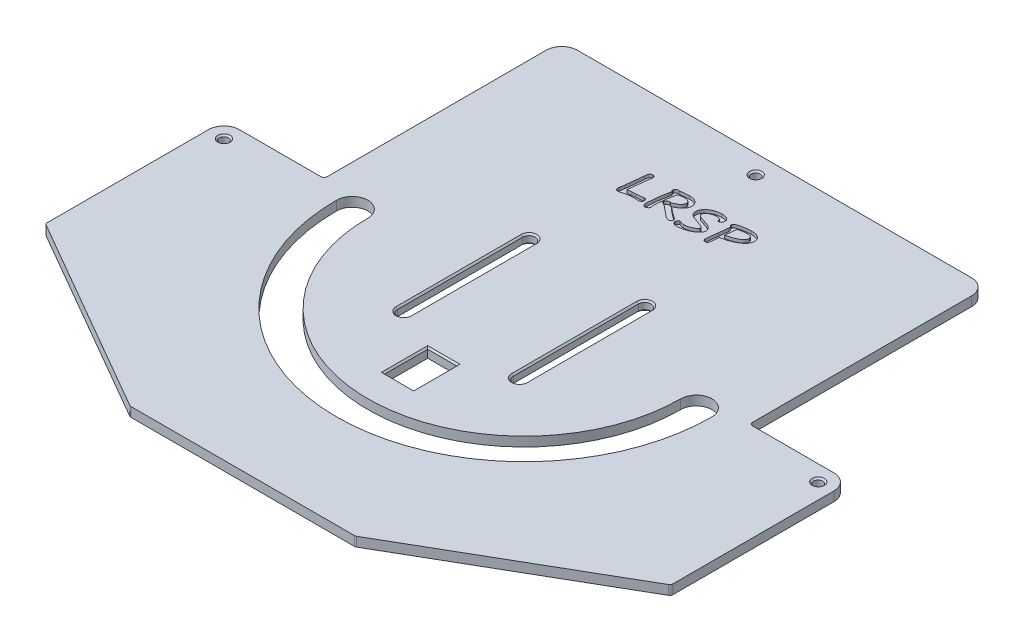
from build123d import *

# Parameters (mm, degrees)
SKETCH_1_R          = 1.45
EXTRUDE_1_DEPTH     = 3
CUT_EXTRUDE_1_DEPTH = 198.253643819
CUT_EXTRUDE_START   = 3
CUT_EXTRUDE_2_DEPTH = 1
CUT_EXTRUDE_3_DEPTH = 198.253643958
SKETCH_5_W          = 9.3
SKETCH_5_H          = 13.8
CUT_EXTRUDE_4_DEPTH = 198.253643958
CHAMFER_1_SIZE      = 0.5


with BuildPart() as part:
    # 草图1 → 凸台-拉伸1 (new body)
    with BuildSketch(Plane(origin=(0, 0, 0), x_dir=(1, 0, 0), z_dir=(0, 1, 0))):
        with BuildLine():
            Line((-100, -81), (-100, -132.472232503))
            ThreePointArc((-100, -132.472232503), (-99.866025404, -132.972232503), (-99.5, -133.338257906))
            Line((-99.5, -133.338257906), (-36.232050808, -169.866025404))
            ThreePointArc((-36.232050808, -169.866025404), (-35.990869853, -169.965925826), (-35.732050808, -170))
            Line((-35.732050808, -170), (35.732050808, -170))
            ThreePointArc((35.732050808, -170), (35.990869853, -169.965925826), (36.232050808, -169.866025404))
            Line((36.232050808, -169.866025404), (99.5, -133.338257906))
            ThreePointArc((99.5, -133.338257906), (99.866025404, -132.972232503), (100, -132.472232503))
            Line((100, -132.472232503), (100, -81))
            ThreePointArc((100, -81), (98.535533906, -77.464466094), (95, -76))
            Line((95, -76), (69, -76))
            ThreePointArc((69, -76), (68.292893219, -75.707106781), (68, -75))
            Line((68, -75), (68, -5))
            ThreePointArc((68, -5), (66.535533906, -1.464466094), (63, 0))
            Line((63, 0), (-63, 0))
            ThreePointArc((-63, 0), (-66.535533906, -1.464466094), (-68, -5))
            Line((-68, -5), (-68, -75))
            ThreePointArc((-68, -75), (-68.292893219, -75.707106781), (-69, -76))
            Line((-69, -76), (-95, -76))
            ThreePointArc((-95, -76), (-98.535533906, -77.464466094), (-100, -81))
        make_face()
        with Locations(Location((95, -81, 0), (0, 0, 270))):
            Circle(SKETCH_1_R, mode=Mode.SUBTRACT)
        with Locations(Location((0, -6, 0), (0, 0, 270))):
            Circle(SKETCH_1_R, mode=Mode.SUBTRACT)
        with Locations(Location((-95, -81, 0), (0, 0, 270))):
            Circle(SKETCH_1_R, mode=Mode.SUBTRACT)
    extrude(amount=EXTRUDE_1_DEPTH)

    # 草图2 → 切除-拉伸1 (cut, through all)
    with BuildSketch(Plane(origin=(0, 0, 0), x_dir=(1, 0, 0), z_dir=(0, 1, 0))):
        with BuildLine():
            Line((16.5, -60), (16.5, -100))
            ThreePointArc((16.5, -100), (18.5, -102), (20.5, -100))
            Line((20.5, -100), (20.5, -60))
            ThreePointArc((20.5, -60), (18.5, -58), (16.5, -60))
        make_face()
        with BuildLine():
            Line((-16.5, -60), (-16.5, -100))
            ThreePointArc((-16.5, -100), (-18.5, -102), (-20.5, -100))
            Line((-20.5, -100), (-20.5, -60))
            ThreePointArc((-20.5, -60), (-18.5, -58), (-16.5, -60))
        make_face()
    extrude(amount=CUT_EXTRUDE_1_DEPTH, mode=Mode.SUBTRACT)

    # 草图3 → 切除-拉伸2 (cut)
    # profile 1 of 4: a face of its own
    with BuildSketch(Plane(origin=(0, 0, 0), x_dir=(1, 0, 0), z_dir=(0, 1, 0)).offset(CUT_EXTRUDE_START)):
        with BuildLine():
            add(Edge.make_bspline(
                [(-11.805058624, -31.89246865), (-11.837123005, -31.89211356), (-11.910680979, -31.89129896), (-12.036132461, -31.881463546), (-12.191190699, -31.870564276), (-12.304554971, -31.858784685), (-12.36595606, -31.852404547)],
                knots=[0, 0, 0, 0, 0.683887348, 1.568886302, 2.683244508, 4, 4, 4, 4], degree=3))
            add(Edge.make_bspline(
                [(-12.36595606, -31.852404547), (-12.428063248, -31.847844528), (-12.543594902, -31.839361991), (-12.703676241, -31.825957517), (-12.837996589, -31.819985546), (-12.918837283, -31.818854564), (-12.954898367, -31.81835006)],
                knots=[0, 0, 0, 0, 1.266455151, 2.355857056, 3.266587467, 4, 4, 4, 4], degree=3))
            add(Edge.make_bspline(
                [(-12.954898367, -31.81835006), (-13.108517727, -31.819693623), (-13.414644899, -31.822371027), (-13.872293221, -31.850057608), (-14.326004476, -31.891489288), (-14.777110999, -31.949829727), (-15.224356833, -32.02517696), (-15.668283462, -32.120738661), (-16.108986773, -32.229610911), (-16.399391583, -32.31600442), (-16.544641957, -32.359215445)],
                knots=[0, 0, 0, 0, 1.011654307, 2.01598857, 3.018559227, 4.011895031, 5.011084001, 6.004741019, 7.002040933, 8, 8, 8, 8], degree=3))
            add(Edge.make_bspline(
                [(-16.544641957, -32.359215445), (-16.601982549, -32.377514955), (-16.712275556, -32.412713545), (-16.872522688, -32.459094565), (-17.019888071, -32.496163081), (-17.153869392, -32.529273345), (-17.274653279, -32.555395488), (-17.383541607, -32.574050853), (-17.479280862, -32.584240884), (-17.538882115, -32.586529099), (-17.566276572, -32.587580829)],
                knots=[0, 0, 0, 0, 1.375863812, 2.64643512, 3.81259638, 4.849189715, 5.801193257, 6.636810002, 7.373438485, 8, 8, 8, 8], degree=3))
            add(Edge.make_bspline(
                [(-17.566276572, -32.587580829), (-17.631583567, -32.584105933), (-17.757890113, -32.577385333), (-17.93566325, -32.514340393), (-18.090841284, -32.411898613), (-18.212948103, -32.270068767), (-18.310372363, -32.115044142), (-18.383290006, -31.958308114), (-18.431409869, -31.804473243), (-18.436977222, -31.701812281), (-18.439674008, -31.652084034)],
                knots=[0, 0, 0, 0, 1.105349252, 2.137793168, 3.159541136, 4.227044925, 5.286817455, 6.260596173, 7.157445041, 8, 8, 8, 8], degree=3))
            add(Edge.make_bspline(
                [(-18.439674008, -31.652084034), (-18.437388787, -31.623990258), (-18.431532784, -31.551998457), (-18.40689988, -31.421959219), (-18.370832083, -31.245036537), (-18.340501669, -31.111824237), (-18.323488111, -31.03710006)],
                knots=[0, 0, 0, 0, 0.539700042, 1.38301016, 2.532024359, 4, 4, 4, 4], degree=3))
            add(Edge.make_bspline(
                [(-18.323488111, -31.03710006), (-18.298612431, -30.931108299), (-18.247341134, -30.712648544), (-18.184728008, -30.372252314), (-18.127764104, -30.010298915), (-18.0982867, -29.761172929), (-18.083103496, -29.632853265)],
                knots=[0, 0, 0, 0, 0.916294122, 1.888575003, 2.912448473, 4, 4, 4, 4], degree=3))
            Line((-18.083103496, -29.632853265), (-17.498167598, -24.089984675))
            add(Edge.make_bspline(
                [(-17.498167598, -24.089984675), (-17.492341064, -24.027198812), (-17.48117916, -23.906919789), (-17.462434783, -23.73612357), (-17.44756252, -23.581589225), (-17.429063775, -23.44556606), (-17.412307155, -23.326164947), (-17.400306101, -23.224110387), (-17.382956418, -23.140407553), (-17.365818601, -23.050570987), (-17.330731889, -22.951494733), (-17.26753322, -22.841050967), (-17.179155897, -22.739823403), (-17.07357773, -22.641821014), (-16.943051152, -22.560146239), (-16.790782566, -22.499140513), (-16.616826586, -22.466016285), (-16.494697433, -22.461664616), (-16.430459265, -22.459375701)],
                knots=[0, 0, 0, 0, 1.354080732, 2.594015579, 3.689841574, 4.687650921, 5.541425648, 6.279598573, 6.892687215, 7.376420873, 8.242628706, 9.135488107, 10.092054636, 11.117406845, 12.219407611, 13.377719284, 14.620718259, 16, 16, 16, 16], degree=3))
            add(Edge.make_bspline(
                [(-16.430459265, -22.459375701), (-16.378005048, -22.461681981), (-16.27364688, -22.466270346), (-16.124028891, -22.515226047), (-15.984408885, -22.590704203), (-15.860812547, -22.694307646), (-15.75732265, -22.814161451), (-15.675089486, -22.940602866), (-15.629714309, -23.076764843), (-15.622660138, -23.168889263), (-15.619161188, -23.214584034)],
                knots=[0, 0, 0, 0, 1.030694139, 2.050575912, 3.069438142, 4.144550581, 5.208080997, 6.183249121, 7.098870669, 8, 8, 8, 8], degree=3))
            add(Edge.make_bspline(
                [(-15.619161188, -23.214584034), (-15.621429489, -23.264688931), (-15.626732962, -23.381838275), (-15.647212489, -23.582636406), (-15.687831619, -23.832483721), (-15.718565685, -24.015885431), (-15.735347085, -24.116026342)],
                knots=[0, 0, 0, 0, 0.661571546, 1.546808336, 2.660509497, 4, 4, 4, 4], degree=3))
            add(Edge.make_bspline(
                [(-15.735347085, -24.116026342), (-15.750161787, -24.202142411), (-15.7828623, -24.392226531), (-15.83339714, -24.70381474), (-15.883905494, -25.06951006), (-15.942882813, -25.487966722), (-16.00445636, -25.960807042), (-16.070456013, -26.487000622), (-16.140262308, -27.066635305), (-16.201143241, -27.57736663), (-16.246618215, -27.995747425), (-16.2838448, -28.29593454), (-16.316200967, -28.57702573), (-16.342940761, -28.839069446), (-16.371477073, -29.081330061), (-16.398287921, -29.304190884), (-16.419546176, -29.508012059), (-16.439811428, -29.692281581), (-16.457523479, -29.856577509), (-16.474440466, -30.001315018), (-16.486056224, -30.126957439), (-16.495356251, -30.233946438), (-16.506100713, -30.321184381), (-16.513034932, -30.389286539), (-16.513854355, -30.437515922), (-16.515858086, -30.462851985), (-16.516597085, -30.472196214)],
                knots=[0, 0, 0, 0, 0.98225695, 2.16813713, 3.548102444, 5.131890826, 6.918528995, 8.908092068, 11.093182547, 13.481289169, 14.689828606, 15.823809401, 16.881492836, 17.870380939, 18.784668621, 19.623531621, 20.393585074, 21.088206459, 21.70739639, 22.251155734, 22.726174843, 23.125760364, 23.458150875, 23.714347134, 23.894647964, 24, 24, 24, 24], degree=3))
            add(Edge.make_bspline(
                [(-16.516597085, -30.472196214), (-16.516451592, -30.500572011), (-16.516199504, -30.549737116), (-16.502129982, -30.608975495), (-16.484554709, -30.655370797), (-16.459502269, -30.661714802), (-16.448488111, -30.664503906)],
                knots=[0, 0, 0, 0, 1.534580987, 2.658879895, 3.41038444, 4, 4, 4, 4], degree=3))
            add(Edge.make_bspline(
                [(-16.448488111, -30.664503906), (-16.422432605, -30.664116521), (-16.360879301, -30.663201365), (-16.254800435, -30.653498551), (-16.119789619, -30.642275442), (-15.95699128, -30.623432742), (-15.765378769, -30.601234428), (-15.546186932, -30.575899683), (-15.298520505, -30.543248579), (-15.124353672, -30.519050902), (-15.032222085, -30.506250701)],
                knots=[0, 0, 0, 0, 0.438554189, 1.036036653, 1.792216727, 2.719537529, 3.79459464, 5.039741336, 6.434068498, 8, 8, 8, 8], degree=3))
            add(Edge.make_bspline(
                [(-15.032222085, -30.506250701), (-14.850125061, -30.483374985), (-14.485378251, -30.437554112), (-14.118288638, -30.41792372), (-13.934465675, -30.40809365)],
                knots=[0, 0, 0, 0, 0.998484535, 2, 2, 2, 2], degree=3))
            add(Edge.make_bspline(
                [(-13.934465675, -30.40809365), (-13.8069182, -30.402302968), (-13.562446946, -30.391203922), (-13.210443186, -30.371739753), (-12.887940585, -30.347532144), (-12.594886284, -30.321094306), (-12.33148015, -30.29638064), (-12.098266775, -30.266574048), (-11.894683883, -30.232627779), (-11.768945088, -30.207398811), (-11.710907983, -30.195753906)],
                knots=[0, 0, 0, 0, 1.370474625, 2.626799539, 3.783936834, 4.841642969, 5.785172089, 6.623501973, 7.364651456, 8, 8, 8, 8], degree=3))
            add(Edge.make_bspline(
                [(-11.710907983, -30.195753906), (-11.678896911, -30.188866273), (-11.620373788, -30.176274198), (-11.538942499, -30.161786807), (-11.471395058, -30.152915833), (-11.430478561, -30.152060624), (-11.412430419, -30.151683393)],
                knots=[0, 0, 0, 0, 1.299758004, 2.376237091, 3.283763088, 4, 4, 4, 4], degree=3))
            add(Edge.make_bspline(
                [(-11.412430419, -30.151683393), (-11.353473662, -30.154369951), (-11.24073914, -30.159507068), (-11.080634745, -30.198509658), (-10.942941107, -30.271503229), (-10.826881349, -30.367546073), (-10.73427764, -30.482485062), (-10.666607791, -30.610134632), (-10.627827595, -30.749768665), (-10.622086292, -30.84589675), (-10.619161188, -30.894872496)],
                knots=[0, 0, 0, 0, 1.161583679, 2.221129313, 3.215774719, 4.206408386, 5.170199741, 6.106009512, 7.035041664, 8, 8, 8, 8], degree=3))
            add(Edge.make_bspline(
                [(-10.619161188, -30.894872496), (-10.622912023, -30.966914554), (-10.630214201, -31.107167027), (-10.701925682, -31.305902822), (-10.81989029, -31.480093904), (-10.97897578, -31.62700503), (-11.166044661, -31.741445847), (-11.366636374, -31.831123765), (-11.582281226, -31.881362764), (-11.730030968, -31.888728376), (-11.805058624, -31.89246865)],
                knots=[0, 0, 0, 0, 1.000384199, 1.947561754, 2.899385267, 3.906104484, 4.93827777, 5.942114557, 6.95500109, 8, 8, 8, 8], degree=3))
        make_face()
    # profile 2 of 4: a face of its own
    with BuildSketch(Plane(origin=(0, 0, 0), x_dir=(1, 0, 0), z_dir=(0, 1, 0)).offset(CUT_EXTRUDE_START)):
        with BuildLine():
            Line((-8.758183624, -24.061939804), (-8.846324649, -23.905689804))
            add(Edge.make_bspline(
                [(-8.846324649, -23.905689804), (-8.881120819, -23.853362679), (-8.944239441, -23.758443724), (-9.020023391, -23.623840745), (-9.069592362, -23.509704791), (-9.07734712, -23.437923948), (-9.080699649, -23.406891727)],
                knots=[0, 0, 0, 0, 1.352017455, 2.452496373, 3.330984787, 4, 4, 4, 4], degree=3))
            add(Edge.make_bspline(
                [(-9.080699649, -23.406891727), (-9.077098919, -23.35413952), (-9.069806607, -23.247304089), (-9.000614074, -23.096188551), (-8.891478568, -22.958202301), (-8.747701806, -22.838424055), (-8.590490842, -22.735805879), (-8.431965684, -22.660783505), (-8.281858313, -22.610039936), (-8.182270625, -22.604311566), (-8.135186829, -22.601603265)],
                knots=[0, 0, 0, 0, 0.934415258, 1.892407207, 2.900174388, 4.045950996, 5.206116578, 6.231935585, 7.164081556, 8, 8, 8, 8], degree=3))
            add(Edge.make_bspline(
                [(-8.135186829, -22.601603265), (-8.088405917, -22.602283304), (-7.983261539, -22.603811753), (-7.878715156, -22.615273267), (-7.820683624, -22.621635316)],
                knots=[0, 0, 0, 0, 0.889841422, 2, 2, 2, 2], degree=3))
            add(Edge.make_bspline(
                [(-7.820683624, -22.621635316), (-7.792001924, -22.625895545), (-7.740704368, -22.633515012), (-7.673039666, -22.640313397), (-7.62450194, -22.647718612), (-7.598339901, -22.649136647), (-7.588311829, -22.649680188)],
                knots=[0, 0, 0, 0, 1.485964319, 2.657664535, 3.485474476, 4, 4, 4, 4], degree=3))
            add(Edge.make_bspline(
                [(-7.588311829, -22.649680188), (-7.428070117, -22.624882597), (-7.119725833, -22.57716596), (-6.676011811, -22.509997198), (-6.269197369, -22.456027596), (-5.899785386, -22.412557044), (-5.56819303, -22.374443097), (-5.273426156, -22.352085155), (-5.016440201, -22.333039212), (-4.857304293, -22.331760847), (-4.783824649, -22.331170573)],
                knots=[0, 0, 0, 0, 1.37768864, 2.651010233, 3.812841483, 4.86417217, 5.811467902, 6.648223788, 7.375828904, 8, 8, 8, 8], degree=3))
            add(Edge.make_bspline(
                [(-4.783824649, -22.331170573), (-4.660878969, -22.333502741), (-4.421177915, -22.338049654), (-4.07174399, -22.372645994), (-3.742211458, -22.428140606), (-3.432217589, -22.50567325), (-3.142008608, -22.607465627), (-2.873060274, -22.735529894), (-2.620412526, -22.879972609), (-2.393204556, -23.051864473), (-2.187680038, -23.236465565), (-2.006923071, -23.433432187), (-1.857496875, -23.643187268), (-1.729085153, -23.860551601), (-1.637755557, -24.092843415), (-1.564540271, -24.332612206), (-1.525182263, -24.584818778), (-1.519485423, -24.756265257), (-1.516597085, -24.843189804)],
                knots=[0, 0, 0, 0, 1.28017223, 2.495887868, 3.652806582, 4.757492117, 5.819780216, 6.84943017, 7.856021703, 8.844850528, 9.809846264, 10.730399304, 11.622027755, 12.487987491, 13.351878693, 14.214425491, 15.094701412, 16, 16, 16, 16], degree=3))
            add(Edge.make_bspline(
                [(-1.516597085, -24.843189804), (-1.519402663, -24.927486402), (-1.525000663, -25.095684318), (-1.567035265, -25.346037578), (-1.632988123, -25.593066336), (-1.726190638, -25.837422465), (-1.846768565, -26.078448325), (-1.996532481, -26.314278545), (-2.169847038, -26.548577769), (-2.369392949, -26.77704815), (-2.592320001, -26.998320188), (-2.831844374, -27.213174224), (-3.09163006, -27.415455366), (-3.368655172, -27.607707731), (-3.663315224, -27.791259122), (-3.978942016, -27.959174704), (-4.308759069, -28.12383421), (-4.5388353, -28.219905712), (-4.655619521, -28.268670573)],
                knots=[0, 0, 0, 0, 0.823035889, 1.64221242, 2.472785214, 3.317047108, 4.19206172, 5.10046756, 6.042255036, 7.036187588, 8.059992077, 9.108570523, 10.177099954, 11.273490121, 12.401056221, 13.565443191, 14.764245144, 16, 16, 16, 16], degree=3))
            add(Edge.make_bspline(
                [(-4.655619521, -28.268670573), (-4.463658652, -28.426682389), (-4.093839976, -28.731097144), (-3.553211253, -29.16464649), (-3.050116759, -29.561364703), (-2.580896941, -29.918114023), (-2.148380612, -30.236984161), (-1.752580481, -30.518159771), (-1.39153328, -30.759521292), (-1.160375643, -30.903432119), (-1.051853496, -30.970994291)],
                knots=[0, 0, 0, 0, 1.323715451, 2.550179614, 3.689517397, 4.734737472, 5.688250265, 6.550342628, 7.319425767, 8, 8, 8, 8], degree=3))
            add(Edge.make_bspline(
                [(-1.051853496, -30.970994291), (-0.985931115, -31.015483091), (-0.862431945, -31.09882853), (-0.72181047, -31.26370776), (-0.632919081, -31.448933213), (-0.623746527, -31.581705207), (-0.619161188, -31.648077624)],
                knots=[0, 0, 0, 0, 1.129677909, 2.1163417, 3.058363512, 4, 4, 4, 4], degree=3))
            add(Edge.make_bspline(
                [(-0.619161188, -31.648077624), (-0.6236489, -31.693295785), (-0.633008355, -31.787601592), (-0.69306841, -31.927007269), (-0.793915295, -32.062205433), (-0.923243209, -32.191516677), (-1.067201443, -32.306748713), (-1.21500773, -32.391961113), (-1.358801291, -32.450069165), (-1.456023721, -32.456362431), (-1.502574649, -32.459375701)],
                knots=[0, 0, 0, 0, 0.841672582, 1.7553702, 2.779405572, 3.965487903, 5.151114612, 6.197517985, 7.136956254, 8, 8, 8, 8], degree=3))
            add(Edge.make_bspline(
                [(-1.502574649, -32.459375701), (-1.570418418, -32.454459035), (-1.712652078, -32.444151302), (-1.930979591, -32.376659045), (-2.160961484, -32.268795308), (-2.359216264, -32.146390938), (-2.526580303, -32.024929882), (-2.672190555, -31.923353839), (-2.829221905, -31.807915058), (-2.997978394, -31.677703528), (-3.181896057, -31.539591316), (-3.376357498, -31.385802356), (-3.584677428, -31.221533165), (-3.801022492, -31.051577577), (-4.008322158, -30.880365487), (-4.201137642, -30.727732929), (-4.368416175, -30.590431107), (-4.510535878, -30.471300654), (-4.63073638, -30.371967932), (-4.726535348, -30.291566376), (-4.796477731, -30.226430213), (-4.835890167, -30.190391844), (-4.851933624, -30.175721855)],
                knots=[0, 0, 0, 0, 0.992333548, 2.080415577, 3.317207631, 4.702550758, 5.480326911, 6.342124064, 7.299371984, 8.330831358, 9.459961446, 10.663564122, 11.957135927, 13.340687425, 14.687658185, 15.889674563, 16.937695597, 17.853118788, 18.602216131, 19.218796807, 19.681998858, 20, 20, 20, 20], degree=3))
            add(Edge.make_bspline(
                [(-4.851933624, -30.175721855), (-4.954527388, -30.089297591), (-5.152198226, -29.922781072), (-5.440451726, -29.687754276), (-5.704086281, -29.473088287), (-5.945522164, -29.281714964), (-6.164721786, -29.113359135), (-6.363420626, -28.969835736), (-6.537413618, -28.846150937), (-6.647917801, -28.774483958), (-6.698888752, -28.741426983)],
                knots=[0, 0, 0, 0, 1.375867385, 2.650929722, 3.814688832, 4.862919684, 5.810835027, 6.649223912, 7.376943574, 8, 8, 8, 8], degree=3))
            add(Edge.make_bspline(
                [(-6.698888752, -28.741426983), (-6.755149165, -28.739103929), (-6.860683598, -28.734746296), (-7.009088622, -28.703089921), (-7.136405674, -28.647807714), (-7.2389643, -28.564809732), (-7.31962569, -28.461587674), (-7.376633044, -28.335519301), (-7.406986309, -28.18661884), (-7.411592505, -28.080502584), (-7.414032983, -28.024279547)],
                knots=[0, 0, 0, 0, 1.162557683, 2.180749487, 3.119881883, 4.003820435, 4.879201571, 5.805770099, 6.837442317, 8, 8, 8, 8], degree=3))
            add(Edge.make_bspline(
                [(-7.414032983, -28.024279547), (-7.410530948, -27.969494487), (-7.403546649, -27.860233667), (-7.334957928, -27.705968704), (-7.233436193, -27.562026856), (-7.089642959, -27.43991738), (-6.924835688, -27.334865579), (-6.742851184, -27.257727281), (-6.548812957, -27.212703896), (-6.416002798, -27.206252717), (-6.348327854, -27.202965445)],
                knots=[0, 0, 0, 0, 0.88284879, 1.760713261, 2.691247739, 3.718031532, 4.79242944, 5.849202722, 6.904036511, 8, 8, 8, 8], degree=3))
            add(Edge.make_bspline(
                [(-6.348327854, -27.202965445), (-6.306761191, -27.204352863), (-6.220189524, -27.207242466), (-6.135792234, -27.22683473), (-6.091917598, -27.237019932)],
                knots=[0, 0, 0, 0, 0.960283305, 2, 2, 2, 2], degree=3))
            add(Edge.make_bspline(
                [(-6.091917598, -27.237019932), (-6.054819293, -27.248505493), (-5.993829061, -27.267387947), (-5.930448012, -27.27435486), (-5.905619521, -27.277084034)],
                knots=[0, 0, 0, 0, 1.216532653, 2, 2, 2, 2], degree=3))
            add(Edge.make_bspline(
                [(-5.905619521, -27.277084034), (-5.86605269, -27.274187642), (-5.778425511, -27.267773111), (-5.637763678, -27.230182047), (-5.475351749, -27.173501025), (-5.290134439, -27.094164885), (-5.082871329, -26.991356733), (-4.852458535, -26.866905319), (-4.600092022, -26.719270112), (-4.330694586, -26.557573938), (-4.066930595, -26.380994518), (-3.832167192, -26.189200737), (-3.631925745, -25.991167468), (-3.46849734, -25.784933444), (-3.341616225, -25.571290567), (-3.250145797, -25.351091522), (-3.193628742, -25.122454633), (-3.18672041, -24.96703126), (-3.183263752, -24.889263521)],
                knots=[0, 0, 0, 0, 0.492315553, 1.090312831, 1.801777391, 2.631306072, 3.592885319, 4.677464868, 5.886326267, 7.227477105, 8.583676426, 9.828377845, 10.99064928, 12.078432911, 13.090707307, 14.06965274, 15.034130202, 16, 16, 16, 16], degree=3))
            add(Edge.make_bspline(
                [(-3.183263752, -24.889263521), (-3.184981702, -24.850452461), (-3.188386055, -24.773543062), (-3.210167585, -24.660493219), (-3.250138784, -24.552880535), (-3.301151394, -24.448031382), (-3.371722104, -24.348959214), (-3.455125608, -24.253126002), (-3.554801097, -24.162950736), (-3.706161544, -24.046398896), (-3.924369393, -23.922306372), (-4.219390754, -23.815278131), (-4.547604995, -23.753945935), (-4.776887676, -23.745707169), (-4.896004137, -23.741426983)],
                knots=[0, 0, 0, 0, 0.613816846, 1.216361632, 1.810804451, 2.424621297, 3.054304903, 3.727701513, 4.43010419, 5.175544776, 6.745703522, 8.375670931, 10.117096107, 12, 12, 12, 12], degree=3))
            add(Edge.make_bspline(
                [(-4.896004137, -23.741426983), (-5.036258213, -23.742279517), (-5.302904626, -23.743900326), (-5.681857272, -23.763960214), (-6.018476397, -23.795934582), (-6.270286829, -23.838199617), (-6.447343233, -23.874075199), (-6.559761041, -23.899446598), (-6.657386684, -23.917228247), (-6.738978706, -23.938971837), (-6.805553128, -23.95538318), (-6.856824763, -23.972152731), (-6.892859688, -23.984816354), (-6.922873553, -24.001599707), (-6.946201818, -24.033218359), (-6.975175398, -24.078428986), (-7.005588156, -24.140038172), (-7.035928351, -24.204881272), (-7.061858209, -24.280742929), (-7.083614926, -24.372419226), (-7.115210181, -24.495420955), (-7.147801978, -24.652185686), (-7.188420508, -24.841559358), (-7.232159444, -25.064004247), (-7.279580371, -25.318660782), (-7.35381113, -25.705196391), (-7.442769989, -26.224736763), (-7.547220501, -26.875778444), (-7.647039138, -27.556974031), (-7.725666074, -28.13813846), (-7.784169272, -28.601014622), (-7.822314893, -28.927542628), (-7.854523114, -29.230030945), (-7.880755239, -29.509147308), (-7.901134989, -29.764242663), (-7.914365755, -29.996039886), (-7.926412161, -30.202976317), (-7.926713127, -30.333292484), (-7.926853496, -30.394071214)],
                knots=[0, 0, 0, 0, 1.771922159, 3.368719813, 4.793351141, 6.041664887, 6.592650871, 7.07584089, 7.497768435, 7.845629237, 8.142362262, 8.36381989, 8.526762793, 8.625152685, 8.792619648, 9.012626137, 9.306950574, 9.658171444, 9.916978341, 10.318062263, 10.848042376, 11.521566247, 12.340637554, 13.295346132, 14.385792407, 15.613580748, 18.268392444, 21.045248707, 23.944634337, 26.966975166, 28.455047556, 29.83956748, 31.120665716, 32.298507489, 33.381716679, 34.353751762, 35.232199048, 36, 36, 36, 36], degree=3))
            add(Edge.make_bspline(
                [(-7.926853496, -30.394071214), (-7.92416747, -30.533255955), (-7.91907297, -30.797243262), (-7.878110111, -31.058037716), (-7.858744521, -31.181330829)],
                knots=[0, 0, 0, 0, 1.054480557, 2, 2, 2, 2], degree=3))
            add(Edge.make_bspline(
                [(-7.858744521, -31.181330829), (-7.840723488, -31.289917214), (-7.807466282, -31.490309704), (-7.801418875, -31.693301739), (-7.798648367, -31.786298778)],
                knots=[0, 0, 0, 0, 1.083737066, 2, 2, 2, 2], degree=3))
            add(Edge.make_bspline(
                [(-7.798648367, -31.786298778), (-7.80235089, -31.828253398), (-7.810181869, -31.916989057), (-7.872695135, -32.047980808), (-7.969998985, -32.180254152), (-8.095594806, -32.31328774), (-8.241909174, -32.433406557), (-8.403484351, -32.521656876), (-8.572363772, -32.576752105), (-8.68834394, -32.5839783), (-8.746164393, -32.587580829)],
                knots=[0, 0, 0, 0, 0.74898579, 1.584134201, 2.552793637, 3.686072934, 4.851129379, 5.926425326, 6.96624544, 8, 8, 8, 8], degree=3))
            add(Edge.make_bspline(
                [(-8.746164393, -32.587580829), (-8.822796913, -32.58441233), (-8.96889831, -32.578371524), (-9.172728003, -32.514114042), (-9.346979421, -32.410548311), (-9.486489241, -32.261475647), (-9.596465623, -32.074509634), (-9.670495215, -31.845706523), (-9.713060079, -31.577552148), (-9.718709681, -31.385830371), (-9.72172529, -31.283494291)],
                knots=[0, 0, 0, 0, 0.988796467, 1.885159767, 2.734259469, 3.583710802, 4.498010154, 5.519926591, 6.676201538, 8, 8, 8, 8], degree=3))
            add(Edge.make_bspline(
                [(-9.72172529, -31.283494291), (-9.720720674, -31.190673098), (-9.718617004, -30.996305204), (-9.708496314, -30.691725691), (-9.690117305, -30.361152105), (-9.663925662, -30.003870504), (-9.629083599, -29.620025834), (-9.589760453, -29.209206428), (-9.540677723, -28.772666293), (-9.470211534, -28.163821705), (-9.371465353, -27.411139456), (-9.235998634, -26.543997983), (-9.097263413, -25.733542634), (-8.987468546, -25.215478124), (-8.934465675, -24.965385316)],
                knots=[0, 0, 0, 0, 0.524152753, 1.097577654, 1.720633769, 2.393569038, 3.120335812, 3.896956661, 4.723890298, 5.600803505, 7.357889577, 9.009942103, 10.556565909, 12, 12, 12, 12], degree=3))
            add(Edge.make_bspline(
                [(-8.934465675, -24.965385316), (-8.919698001, -24.891949802), (-8.891918149, -24.753808361), (-8.864961059, -24.615504064), (-8.852334265, -24.550721855)],
                knots=[0, 0, 0, 0, 1.063193105, 2, 2, 2, 2], degree=3))
            Line((-8.852334265, -24.550721855), (-8.758183624, -24.061939804))
        make_face()
    # profile 3 of 4: a face of its own
    with BuildSketch(Plane(origin=(0, 0, 0), x_dir=(1, 0, 0), z_dir=(0, 1, 0)).offset(CUT_EXTRUDE_START)):
        with BuildLine():
            add(Edge.make_bspline(
                [(6.68853112, -24.895273137), (6.687310735, -24.843146903), (6.684957746, -24.74264381), (6.668992872, -24.598563835), (6.643246644, -24.466238307), (6.60620589, -24.346002786), (6.555152891, -24.238843373), (6.495641755, -24.143713509), (6.423548799, -24.06173545), (6.312035651, -23.966817231), (6.14069205, -23.874175012), (5.903210062, -23.793824533), (5.624407853, -23.74985105), (5.425990198, -23.744353939), (5.320342017, -23.741426983)],
                knots=[0, 0, 0, 0, 0.906402374, 1.747608368, 2.517333154, 3.24814885, 3.928613535, 4.576077804, 5.193261821, 5.819231433, 7.114055839, 8.549859266, 10.162960399, 12, 12, 12, 12], degree=3))
            add(Edge.make_bspline(
                [(5.320342017, -23.741426983), (5.225464005, -23.742812389), (5.036679126, -23.745569019), (4.756277085, -23.772443186), (4.480535973, -23.816336847), (4.210468911, -23.878979004), (3.945090947, -23.956584552), (3.685607631, -24.053543037), (3.431608058, -24.167824169), (3.186766304, -24.296232364), (2.958506434, -24.433380716), (2.758193123, -24.579043774), (2.588346525, -24.727783292), (2.4471134, -24.878595531), (2.337762206, -25.034904198), (2.259996702, -25.195784621), (2.211059341, -25.360513858), (2.204576995, -25.472544085), (2.201351633, -25.528285957)],
                knots=[0, 0, 0, 0, 1.173513515, 2.335015257, 3.481258319, 4.625505193, 5.762542775, 6.899580358, 8.049538388, 9.20609429, 10.318252372, 11.341037553, 12.265816017, 13.107698889, 13.891396945, 14.615581821, 15.3111675, 16, 16, 16, 16], degree=3))
            add(Edge.make_bspline(
                [(2.201351633, -25.528285957), (2.205072602, -25.597081827), (2.212465609, -25.73376886), (2.288316277, -25.927573707), (2.402897212, -26.106971406), (2.539664619, -26.240368049), (2.683466446, -26.341223004), (2.829871825, -26.423249007), (3.012041746, -26.50760941), (3.230121775, -26.597900201), (3.4834431, -26.693060574), (3.773185829, -26.79370741), (4.099107307, -26.896467363), (4.328687645, -26.966145641), (4.448947787, -27.002644932)],
                knots=[0, 0, 0, 0, 0.857806506, 1.704332341, 2.569442913, 3.509531975, 4.073290341, 4.766075466, 5.607631439, 6.585913625, 7.721123853, 8.995679988, 10.426259167, 12, 12, 12, 12], degree=3))
            add(Edge.make_bspline(
                [(4.448947787, -27.002644932), (4.577327682, -27.041473636), (4.826977586, -27.116980648), (5.187597068, -27.236300676), (5.52192734, -27.360902577), (5.831402971, -27.486049543), (6.113667353, -27.616670833), (6.371413697, -27.747819824), (6.602021371, -27.884928361), (6.809590199, -28.02194613), (6.992234367, -28.165534744), (7.151157154, -28.314650314), (7.284787856, -28.473088764), (7.396800004, -28.63707537), (7.481051863, -28.81097234), (7.541668964, -28.990610785), (7.579341342, -29.177228317), (7.583739601, -29.304152048), (7.585967017, -29.368430188)],
                knots=[0, 0, 0, 0, 1.533278363, 2.981641283, 4.341462187, 5.611592881, 6.796784914, 7.8961211, 8.915963566, 9.862338178, 10.737403261, 11.568934021, 12.348901324, 13.10261463, 13.8332049, 14.55014861, 15.265749993, 16, 16, 16, 16], degree=3))
            add(Edge.make_bspline(
                [(7.585967017, -29.368430188), (7.584272986, -29.422587703), (7.580892152, -29.530671677), (7.558190599, -29.692386563), (7.520575101, -29.85220566), (7.465367625, -30.010245798), (7.394775333, -30.165889049), (7.311302478, -30.320932182), (7.209045609, -30.471337715), (7.0946773, -30.622321026), (6.965129318, -30.772486485), (6.816945015, -30.918659969), (6.655924043, -31.064630782), (6.477725696, -31.207108286), (6.286042979, -31.348905232), (6.07907194, -31.489543), (5.856428168, -31.627696621), (5.540222527, -31.807389378), (5.133325726, -32.018529706), (4.634085506, -32.238905592), (4.130444465, -32.425902051), (3.622044818, -32.578823562), (3.108144735, -32.697679918), (2.588690612, -32.780419513), (2.065002719, -32.835902521), (1.71404616, -32.84129206), (1.538290735, -32.843991086)],
                knots=[0, 0, 0, 0, 0.5187735, 1.035333725, 1.561313845, 2.089312793, 2.636193803, 3.197256931, 3.773858138, 4.376450433, 5.011316299, 5.671708173, 6.369225161, 7.092518106, 7.856315086, 8.652943441, 9.488995308, 10.365732564, 12.136680431, 13.87798964, 15.590258505, 17.28009585, 18.960608946, 20.639026699, 22.316859238, 24, 24, 24, 24], degree=3))
            add(Edge.make_bspline(
                [(1.538290735, -32.843991086), (1.429222324, -32.840828202), (1.220955339, -32.834788651), (0.92476949, -32.781275041), (0.66296317, -32.688893179), (0.437472808, -32.563420756), (0.253825275, -32.411465981), (0.121071826, -32.236698299), (0.035949763, -32.04391957), (0.026589867, -31.9073369), (0.021864453, -31.838382111)],
                knots=[0, 0, 0, 0, 1.297603202, 2.477783481, 3.566400177, 4.587824728, 5.535348993, 6.381086706, 7.182679451, 8, 8, 8, 8], degree=3))
            add(Edge.make_bspline(
                [(0.021864453, -31.838382111), (0.024242678, -31.782781403), (0.028930305, -31.673188992), (0.064465704, -31.511749221), (0.122994822, -31.356511765), (0.203084243, -31.211937365), (0.298544552, -31.086158261), (0.40731329, -30.99011429), (0.53014087, -30.931481189), (0.616247426, -30.924413686), (0.658883684, -30.920914163)],
                knots=[0, 0, 0, 0, 1.09104836, 2.150523334, 3.229292305, 4.338466151, 5.384880842, 6.314926839, 7.165624346, 8, 8, 8, 8], degree=3))
            add(Edge.make_bspline(
                [(0.658883684, -30.920914163), (0.710854221, -30.922816351), (0.812145746, -30.926523751), (0.907113182, -30.961820417), (0.953354838, -30.979007111)],
                knots=[0, 0, 0, 0, 1.02615765, 2, 2, 2, 2], degree=3))
            add(Edge.make_bspline(
                [(0.953354838, -30.979007111), (1.067995559, -31.028770761), (1.289682123, -31.125001249), (1.626187851, -31.226474404), (1.950272859, -31.293675718), (2.163652875, -31.301650161), (2.267457402, -31.305529547)],
                knots=[0, 0, 0, 0, 1.098568057, 2.124356644, 3.08754215, 4, 4, 4, 4], degree=3))
            add(Edge.make_bspline(
                [(2.267457402, -31.305529547), (2.356342169, -31.30344156), (2.536532428, -31.29920872), (2.810698685, -31.269150201), (3.09269425, -31.224417084), (3.381953316, -31.155434154), (3.680858233, -31.07600407), (3.985231314, -30.968242858), (4.299980578, -30.850179449), (4.613523651, -30.711645692), (4.911745118, -30.566828992), (5.178132326, -30.418985178), (5.403151362, -30.271774242), (5.588213054, -30.125578113), (5.733693195, -29.979317315), (5.83760298, -29.832192101), (5.907208228, -29.684715245), (5.915372295, -29.58342902), (5.919300351, -29.534696214)],
                knots=[0, 0, 0, 0, 0.998407811, 2.024006686, 3.095701557, 4.203923579, 5.363194645, 6.568305019, 7.829119502, 9.13920479, 10.417417365, 11.552604318, 12.559598689, 13.434741063, 14.198645492, 14.866660536, 15.454705579, 16, 16, 16, 16], degree=3))
            add(Edge.make_bspline(
                [(5.919300351, -29.534696214), (5.915294585, -29.494516787), (5.906886553, -29.410180861), (5.83654598, -29.29114248), (5.73141684, -29.175616205), (5.612038024, -29.086312717), (5.493775784, -29.010900399), (5.3783305, -28.95186994), (5.24249548, -28.888260401), (5.085552109, -28.820023493), (4.908028807, -28.748158392), (4.708622554, -28.674348438), (4.488281434, -28.596114375), (4.333514472, -28.544198895), (4.252633684, -28.517068009)],
                knots=[0, 0, 0, 0, 0.705055393, 1.479899142, 2.381053134, 3.45574198, 4.096430202, 4.855344606, 5.740803536, 6.743317339, 7.874456067, 9.119680589, 10.494753019, 12, 12, 12, 12], degree=3))
            add(Edge.make_bspline(
                [(4.252633684, -28.517068009), (4.133635511, -28.478087749), (3.903260321, -28.402623692), (3.571240559, -28.286318736), (3.259695649, -28.183022446), (2.973672178, -28.075868838), (2.707183104, -27.982197488), (2.464749045, -27.888975553), (2.244904841, -27.803236955), (1.985988013, -27.699624142), (1.697918378, -27.560244029), (1.390623639, -27.367875724), (1.130344493, -27.147994184), (0.911781015, -26.905798525), (0.73940036, -26.636019017), (0.6225943, -26.33695782), (0.547118471, -26.014113333), (0.538906126, -25.789811476), (0.534684966, -25.674519932)],
                knots=[0, 0, 0, 0, 1.187231806, 2.298428188, 3.335533646, 4.298883082, 5.194081272, 6.01363673, 6.761378685, 7.431520568, 8.657552091, 9.790397189, 10.859624885, 11.877517786, 12.87343661, 13.876274057, 14.908401178, 16, 16, 16, 16], degree=3))
            add(Edge.make_bspline(
                [(0.534684966, -25.674519932), (0.539653727, -25.568679781), (0.549598467, -25.356845728), (0.619992669, -25.042488721), (0.738772708, -24.735351242), (0.902027256, -24.433546638), (1.114051463, -24.139447584), (1.370568698, -23.850543928), (1.671947569, -23.566085746), (2.015441333, -23.293354343), (2.389668958, -23.040040784), (2.784502779, -22.814191292), (3.197738734, -22.625251109), (3.626814263, -22.471296755), (4.071584716, -22.3506576), (4.532292199, -22.264111049), (5.009406403, -22.214175793), (5.332914769, -22.206732218), (5.496624069, -22.202965445)],
                knots=[0, 0, 0, 0, 0.767401818, 1.535918413, 2.323829708, 3.149434188, 4.017565943, 4.947439468, 5.94777927, 7.019533282, 8.12502747, 9.222515199, 10.314732901, 11.416188546, 12.525241406, 13.65367676, 14.812658419, 16, 16, 16, 16], degree=3))
            add(Edge.make_bspline(
                [(5.496624069, -22.202965445), (5.589465873, -22.204814564), (5.770690047, -22.208423986), (6.035785266, -22.227477202), (6.285978684, -22.263700776), (6.521080197, -22.313264793), (6.74015625, -22.377320083), (6.944510201, -22.455120406), (7.132629262, -22.550214484), (7.306678431, -22.655305481), (7.461909041, -22.770553496), (7.596340027, -22.891510578), (7.713208059, -23.013335752), (7.805525676, -23.142845223), (7.878942628, -23.275785858), (7.931210414, -23.413285632), (7.965420642, -23.554795195), (7.968858885, -23.65108945), (7.970582402, -23.699359675)],
                knots=[0, 0, 0, 0, 1.40143273, 2.735550995, 4.008304895, 5.214057515, 6.35892893, 7.450064129, 8.509221683, 9.535900356, 10.515497815, 11.421908727, 12.263292432, 13.057608652, 13.815276371, 14.548971511, 15.272630835, 16, 16, 16, 16], degree=3))
            add(Edge.make_bspline(
                [(7.970582402, -23.699359675), (7.967285871, -23.793219112), (7.96106139, -23.970443656), (7.900365097, -24.218465901), (7.800198387, -24.430584951), (7.655788077, -24.60470158), (7.46880874, -24.737398727), (7.24325449, -24.831436913), (6.978318999, -24.887072594), (6.788979271, -24.892430612), (6.68853112, -24.895273137)],
                knots=[0, 0, 0, 0, 1.119776942, 2.114352742, 3.027799396, 3.900150592, 4.785861252, 5.740201081, 6.801135797, 8, 8, 8, 8], degree=3))
        make_face()
    # profile 4 of 4: a face of its own
    with BuildSketch(Plane(origin=(0, 0, 0), x_dir=(1, 0, 0), z_dir=(0, 1, 0)).offset(CUT_EXTRUDE_START)):
        with BuildLine():
            add(Edge.make_bspline(
                [(11.484204197, -29.146074419), (11.469807947, -29.272237443), (11.441716876, -29.518416444), (11.406933861, -29.878528556), (11.372873529, -30.219470389), (11.350538553, -30.541585363), (11.32912404, -30.843962299), (11.316212188, -31.127189379), (11.304185998, -31.390899885), (11.304003406, -31.56059152), (11.303915735, -31.642068009)],
                knots=[0, 0, 0, 0, 1.217178244, 2.375051844, 3.467980796, 4.501353117, 5.469977023, 6.373588232, 7.219087491, 8, 8, 8, 8], degree=3))
            add(Edge.make_bspline(
                [(11.303915735, -31.642068009), (11.301253598, -31.701734635), (11.295980588, -31.81991889), (11.252877981, -31.991678691), (11.180635854, -32.15285882), (11.084771866, -32.301480177), (10.964024726, -32.428572868), (10.818553155, -32.52300124), (10.650657012, -32.577958055), (10.531747311, -32.584312317), (10.470582402, -32.587580829)],
                knots=[0, 0, 0, 0, 1.018090122, 2.01657495, 3.001948852, 4.023609441, 5.02365603, 5.972657646, 6.957173294, 8, 8, 8, 8], degree=3))
            add(Edge.make_bspline(
                [(10.470582402, -32.587580829), (10.405598067, -32.584408), (10.281991285, -32.578372959), (10.107950678, -32.535929084), (9.960921263, -32.456984181), (9.838874889, -32.348905069), (9.74807582, -32.206749066), (9.681405211, -32.037675063), (9.645210576, -31.83786496), (9.640011835, -31.695623907), (9.637249069, -31.620032752)],
                knots=[0, 0, 0, 0, 1.068273918, 2.031965086, 2.915846185, 3.786336972, 4.681324581, 5.661685234, 6.757349526, 8, 8, 8, 8], degree=3))
            add(Edge.make_bspline(
                [(9.637249069, -31.620032752), (9.637858763, -31.594657469), (9.639238999, -31.537212488), (9.643046926, -31.440993063), (9.651492892, -31.324803282), (9.663468742, -31.188564103), (9.680290347, -31.032457151), (9.697445886, -30.856011709), (9.720485092, -30.659877764), (9.743583249, -30.44401747), (9.772161987, -30.208361248), (9.804465431, -29.953401696), (9.838050624, -29.67815138), (9.876380909, -29.383042996), (9.918724785, -29.067997093), (9.962323353, -28.732642433), (10.010557945, -28.378093163), (10.044491647, -28.135113005), (10.061928556, -28.010257111)],
                knots=[0, 0, 0, 0, 0.335109554, 0.758626497, 1.271146991, 1.872938208, 2.564163811, 3.34398505, 4.213341121, 5.171287188, 6.210072568, 7.347253444, 8.564256161, 9.870932162, 11.276049155, 12.760977562, 14.335621121, 16, 16, 16, 16], degree=3))
            add(Edge.make_bspline(
                [(10.061928556, -28.010257111), (10.076146155, -27.90945555), (10.103909404, -27.712616486), (10.141205055, -27.424628839), (10.17729612, -27.152864996), (10.211383666, -26.897128322), (10.244303476, -26.656939931), (10.271100835, -26.431670147), (10.298450247, -26.222239519), (10.319509996, -26.029067081), (10.3398067, -25.851482826), (10.358427938, -25.690019087), (10.371934368, -25.543658156), (10.383994292, -25.412791048), (10.394657002, -25.29803038), (10.400290186, -25.19845119), (10.40460524, -25.114988544), (10.405900572, -25.064213482), (10.406479838, -25.041507111)],
                knots=[0, 0, 0, 0, 1.634425074, 3.191604365, 4.662351724, 6.036040639, 7.33392499, 8.554640685, 9.67828355, 10.724869061, 11.674373633, 12.54810455, 13.334314738, 14.034131007, 14.658245191, 15.184549334, 15.635334274, 16, 16, 16, 16], degree=3))
            add(Edge.make_bspline(
                [(10.406479838, -25.041507111), (10.407040708, -24.959928998), (10.408025139, -24.816744247), (10.39458502, -24.632545991), (10.389789015, -24.503989463), (10.366614296, -24.442352895), (10.358402915, -24.420513521)],
                knots=[0, 0, 0, 0, 1.562589422, 2.742634852, 3.554484164, 4, 4, 4, 4], degree=3))
            add(Edge.make_bspline(
                [(10.358402915, -24.420513521), (10.321760582, -24.400774752), (10.250278162, -24.362268062), (10.15452567, -24.289163849), (10.074173951, -24.204161178), (10.006281994, -24.109188841), (9.9563717, -24.000858011), (9.920748292, -23.882145485), (9.89818685, -23.752280392), (9.895206572, -23.662062673), (9.893659325, -23.61522506)],
                knots=[0, 0, 0, 0, 1.011965877, 1.974158404, 2.916798615, 3.850145955, 4.802543163, 5.805068364, 6.860474875, 8, 8, 8, 8], degree=3))
            add(Edge.make_bspline(
                [(9.893659325, -23.61522506), (9.899390994, -23.567228007), (9.911514747, -23.465703574), (10.011155204, -23.326640248), (10.159774746, -23.197437786), (10.364595892, -23.072122386), (10.624830862, -22.951277675), (10.942806167, -22.837499664), (11.316700631, -22.725777647), (11.735688866, -22.622091838), (12.175156782, -22.527516841), (12.609892878, -22.441273669), (13.028213475, -22.365547476), (13.430738083, -22.308687329), (13.816055336, -22.261963066), (14.184703255, -22.227423934), (14.536836505, -22.206323955), (14.766095176, -22.204064642), (14.877633684, -22.202965445)],
                knots=[0, 0, 0, 0, 0.425962692, 0.901005745, 1.479805833, 2.185050015, 3.036515544, 4.040818661, 5.199894269, 6.522647554, 7.896693603, 9.216711933, 10.483209184, 11.694997366, 12.848854418, 13.951460572, 15.003348353, 16, 16, 16, 16], degree=3))
            add(Edge.make_bspline(
                [(14.877633684, -22.202965445), (15.001906444, -22.204727713), (15.24481981, -22.208172382), (15.599174643, -22.239666307), (15.935003677, -22.285455821), (16.249912859, -22.356692768), (16.546335737, -22.444188725), (16.823425945, -22.552125114), (17.081171185, -22.680468557), (17.317219107, -22.828296705), (17.530000833, -22.992584223), (17.718002817, -23.170239893), (17.875464841, -23.364633632), (18.005659713, -23.57186831), (18.103503068, -23.795215804), (18.17655939, -24.030079295), (18.21938459, -24.280068179), (18.224414666, -24.451064411), (18.226992658, -24.538702624)],
                knots=[0, 0, 0, 0, 1.303565921, 2.548053038, 3.730056609, 4.856981525, 5.931991618, 6.970187644, 7.97278873, 8.948596022, 9.887489583, 10.789319106, 11.655899601, 12.505462834, 13.349112562, 14.206725981, 15.080919336, 16, 16, 16, 16], degree=3))
            add(Edge.make_bspline(
                [(18.226992658, -24.538702624), (18.221964011, -24.665946903), (18.211943106, -24.919514698), (18.131639946, -25.293228931), (17.996297708, -25.653104961), (17.813118078, -26.00308355), (17.573116815, -26.337865681), (17.284351598, -26.662786946), (16.941143094, -26.973044003), (16.549822854, -27.267250414), (16.123841958, -27.547513651), (15.670655958, -27.807822036), (15.194533963, -28.045817373), (14.697032288, -28.265290958), (14.17539119, -28.460411737), (13.632226163, -28.636938379), (13.066815612, -28.792139998), (12.679885801, -28.875476874), (12.483803556, -28.917709034)],
                knots=[0, 0, 0, 0, 0.787478646, 1.569258943, 2.354247609, 3.162523293, 4.008048695, 4.898457699, 5.849722503, 6.867770408, 7.92745751, 9.00553207, 10.102114552, 11.222260583, 12.371183511, 13.549356041, 14.758100934, 16, 16, 16, 16], degree=3))
            add(Edge.make_bspline(
                [(12.483803556, -28.917709034), (12.414281431, -28.931362497), (12.283707773, -28.957005881), (12.100702497, -28.998681239), (11.940257647, -29.03247607), (11.802808434, -29.060822984), (11.690009084, -29.090595751), (11.600177156, -29.111784359), (11.533757655, -29.128987979), (11.498181674, -29.14125487), (11.484204197, -29.146074419)],
                knots=[0, 0, 0, 0, 1.657607838, 3.113252381, 4.391017582, 5.494198131, 6.396024552, 7.11976912, 7.654165354, 8, 8, 8, 8], degree=3))
        make_face()
        with BuildLine():
            Line((12.129236248, -24.108013521), (11.702553556, -27.627644932))
            add(Edge.make_bspline(
                [(11.702553556, -27.627644932), (11.86175012, -27.599650359), (12.176046766, -27.544381576), (12.637289105, -27.438405705), (13.084226096, -27.321597029), (13.515891714, -27.186829834), (13.933049058, -27.036686606), (14.336222972, -26.870453445), (14.724369222, -26.688134565), (15.093510558, -26.494432157), (15.433697559, -26.292528279), (15.73094199, -26.07954767), (15.985029981, -25.866003034), (16.195779936, -25.649903846), (16.355777807, -25.425346669), (16.472394743, -25.198527343), (16.548337368, -24.966849538), (16.556360768, -24.809013875), (16.560325992, -24.731010316)],
                knots=[0, 0, 0, 0, 1.294857888, 2.55639619, 3.790478289, 4.995268295, 6.178181828, 7.34158992, 8.487984637, 9.612741257, 10.680717486, 11.654638362, 12.53899514, 13.33742502, 14.066311354, 14.738637098, 15.37662507, 16, 16, 16, 16], degree=3))
            add(Edge.make_bspline(
                [(16.560325992, -24.731010316), (16.559663728, -24.685481396), (16.55837922, -24.597174735), (16.53432522, -24.469830597), (16.501626368, -24.350884614), (16.452694735, -24.240999906), (16.38962898, -24.140868307), (16.31587663, -24.046328606), (16.223073983, -23.965791115), (16.121911442, -23.886871703), (16.001313464, -23.825542361), (15.871388709, -23.765674109), (15.726100297, -23.718285875), (15.567125466, -23.680869644), (15.395152547, -23.651151095), (15.209270196, -23.629364099), (15.010076487, -23.614829339), (14.872318889, -23.61376759), (14.801511889, -23.613221855)],
                knots=[0, 0, 0, 0, 0.925665571, 1.7953959, 2.630409667, 3.434046954, 4.234109169, 5.036940573, 5.864836352, 6.729768867, 7.642557785, 8.610513646, 9.642643173, 10.747639211, 11.934853026, 13.194918496, 14.558196364, 16, 16, 16, 16], degree=3))
            add(Edge.make_bspline(
                [(14.801511889, -23.613221855), (14.698653391, -23.615038033), (14.490044968, -23.618721443), (14.173624505, -23.640342033), (13.850423218, -23.681911263), (13.51975496, -23.736262923), (13.180993059, -23.803044761), (12.836383001, -23.891411785), (12.483590692, -23.989916112), (12.248452114, -24.068281877), (12.129236248, -24.108013521)],
                knots=[0, 0, 0, 0, 0.904410483, 1.834244586, 2.786710869, 3.768278884, 4.780326393, 5.821184032, 6.895334687, 8, 8, 8, 8], degree=3))
        make_face(mode=Mode.SUBTRACT)
    extrude(amount=-CUT_EXTRUDE_2_DEPTH, mode=Mode.SUBTRACT)

    # 草图4 → 切除-拉伸3 (cut, through all)
    with BuildSketch(Plane(origin=(0, 0, 0), x_dir=(1, 0, 0), z_dir=(0, 1, 0))):
        with BuildLine():
            ThreePointArc((-60, -79.999999998), (0, -139.999999998), (60, -79.999999998))
            ThreePointArc((60, -79.999999998), (55, -74.999999998), (50, -79.999999998))
            ThreePointArc((50, -79.999999998), (0, -129.999999998), (-50, -79.999999998))
            ThreePointArc((-50, -79.999999998), (-55, -74.999999998), (-60, -79.999999998))
        make_face()
    extrude(amount=CUT_EXTRUDE_3_DEPTH, mode=Mode.SUBTRACT)

    # 草图5 → 切除-拉伸4 (cut, through all)
    with BuildSketch(Plane(origin=(0, 0, 0), x_dir=(1, 0, 0), z_dir=(0, 1, 0))):
        with Locations((0, -113.1)):
            Rectangle(SKETCH_5_W, SKETCH_5_H)
    extrude(amount=CUT_EXTRUDE_4_DEPTH, mode=Mode.SUBTRACT)

    # 倒角1
    chamfer_1_edges = [part.edges().sort_by_distance(p)[0] for p in [
        (0, 3, 120),
        (4.65, 3, 113.1),
        (0, 3, 106.2),
        (-4.65, 3, 113.1),
        (95, 3, 79.55),
        (0, 3, 4.55),
        (-95, 3, 79.55),
        (-18.5, 0, 58),
        (-20.5, 0, 80),
        (-18.5, 0, 102),
        (-16.5, 0, 80),
        (-18.5, 3, 58),
        (-20.5, 3, 80),
        (-18.5, 3, 102),
        (-16.5, 3, 80),
        (18.5, 0, 58),
        (16.5, 0, 80),
        (18.5, 0, 102),
        (20.5, 0, 80),
        (18.5, 3, 58),
        (16.5, 3, 80),
        (18.5, 3, 102),
        (20.5, 3, 80),
    ]]
    chamfer(chamfer_1_edges, length=CHAMFER_1_SIZE)


solid = part.part
